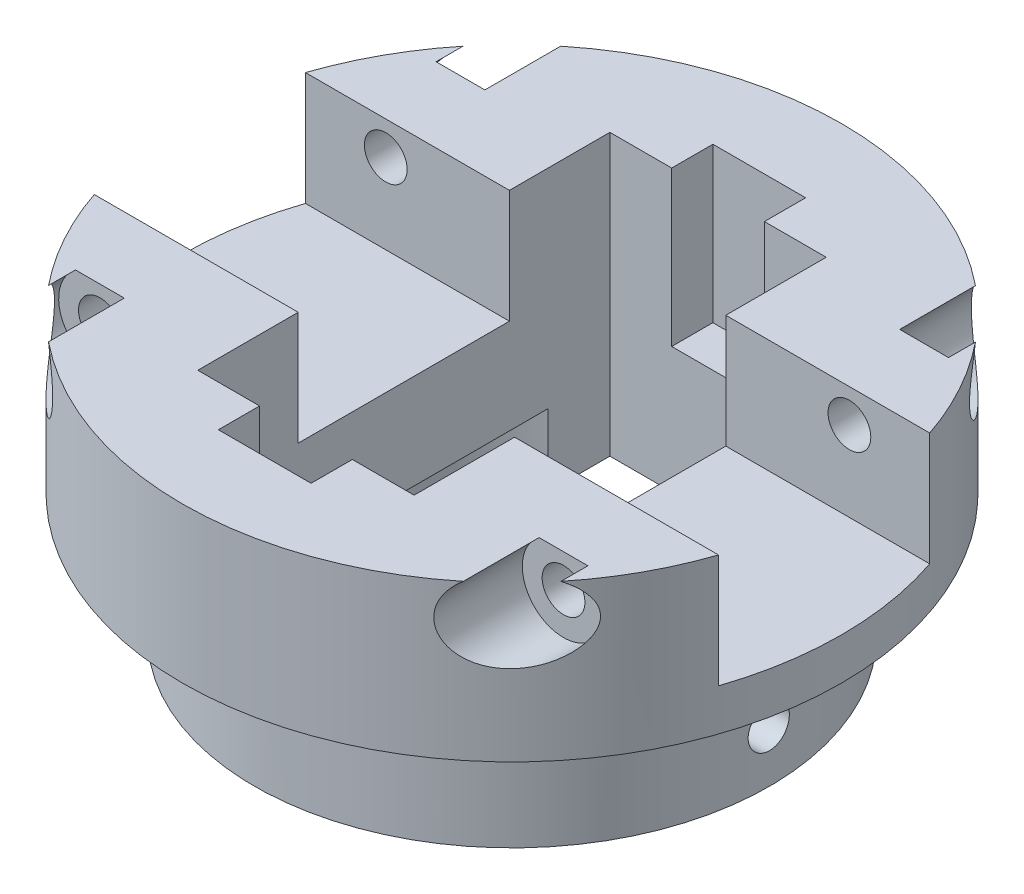
from build123d import *

# Parameters (mm, degrees)
SKETCH1_R               = 22
BOSS_EXTRUDE1_DEPTH     = 5
SKETCH2_R               = 25
BOSS_EXTRUDE2_DEPTH     = 5
SKETCH3_R               = 7.5
CUT_EXTRUDE1_DEPTH      = 16
SKETCH5_W               = 72.120743336
SKETCH5_H               = 20.5
CUT_EXTRUDE2_DEPTH      = 11
CUT_EXTRUDE3_DEPTH      = 53.792161073
CUT_EXTRUDE3_DEPTH_BACK = 53.792161073
SKETCH6_R               = 2.075
BOSS_EXTRUDE3_START     = 5
SKETCH7_R               = 25
SKETCH7_R_2             = 12.5
BOSS_EXTRUDE3_DEPTH     = 5
CUT_EXTRUDE4_DEPTH      = 53.792161246
CUT_EXTRUDE4_DEPTH_BACK = 53.792161246
SKETCH8_R               = 2
SKETCH9_W               = 21
SKETCH9_H               = 40
CUT_EXTRUDE5_DEPTH      = 31
SKETCH11_R              = 17.5
CUT_EXTRUDE7_DEPTH      = 7
CUT_EXTRUDE10_START     = 26.5
SKETCH14_R              = 4
CUT_EXTRUDE10_DEPTH     = 9
SKETCH21_W              = 9
SKETCH21_H              = 4
CUT_EXTRUDE12_DEPTH     = 15
SKETCH22_W              = 9
SKETCH22_H              = 4
CUT_EXTRUDE13_DEPTH     = 15
CUT_EXTRUDE14_START     = -17.5
SKETCH24_R              = 4
CUT_EXTRUDE14_DEPTH     = 15
CUT_EXTRUDE15_START     = -17.5
SKETCH25_R              = 4
CUT_EXTRUDE15_DEPTH     = 15
CUT_EXTRUDE16_START     = 32.5
SKETCH26_R              = 4
CUT_EXTRUDE16_DEPTH     = 15


with BuildPart() as part:
    # Sketch1 → Boss-Extrude1 (new body)
    with BuildSketch(Plane(origin=(0, 0, 0), x_dir=(1, 0, 0), z_dir=(0, 1, 0))):
        Circle(SKETCH1_R)
    extrude(amount=BOSS_EXTRUDE1_DEPTH)

    # Sketch2 → Boss-Extrude2 (add)
    with BuildSketch(Plane(origin=(0, 5, 0), x_dir=(1, 0, 0), z_dir=(0, 1, 0))):
        Circle(SKETCH2_R)
    extrude(amount=BOSS_EXTRUDE2_DEPTH)

    # Sketch3 → Cut-Extrude1 (cut)
    with BuildSketch(Plane(origin=(0, 10, 0), x_dir=(1, 0, 0), z_dir=(0, 1, 0))):
        Circle(SKETCH3_R)
    extrude(amount=-CUT_EXTRUDE1_DEPTH, mode=Mode.SUBTRACT)

    # Sketch4 → Revolve1 (revolve)
    with BuildSketch(Plane(origin=(0, 0, 0), x_dir=(0, 0, -1), z_dir=(1, 0, 0))):
        Polygon((-9.617585302, 7.278489703), (-16.698024184, 7.278489703), (-31.98380954, 12.164514858), (-31.98380954, 27.222860345), (-9.617585302, 27.222860345), align=None)
    revolve(axis=Axis((0, 0, 0), (0, 1, 0)))

    # Sketch5 → Cut-Extrude2 (cut)
    with BuildSketch(Plane(origin=(0, 27.222860345, 0), x_dir=(1, 0, 0), z_dir=(0, 1, 0))):
        Rectangle(SKETCH5_W, SKETCH5_H)
    extrude(amount=-CUT_EXTRUDE2_DEPTH, mode=Mode.SUBTRACT)

    # Sketch6 → Cut-Extrude3 (cut, two sides: drawn at the far end of the back side and taken through both)
    with BuildSketch(Plane.XY.offset(-CUT_EXTRUDE3_DEPTH_BACK)):
        with Locations((-22.5, 24)):
            Circle(SKETCH6_R)
        with Locations((22.5, 24)):
            Circle(SKETCH6_R)
    extrude(amount=CUT_EXTRUDE3_DEPTH + CUT_EXTRUDE3_DEPTH_BACK, mode=Mode.SUBTRACT)

    # Sketch7 → Boss-Extrude3 (add)
    with BuildSketch(Plane.XZ.offset(-5).offset(BOSS_EXTRUDE3_START)):
        Circle(SKETCH7_R)
        Circle(SKETCH7_R_2, mode=Mode.SUBTRACT)
    extrude(amount=-BOSS_EXTRUDE3_DEPTH)

    # Sketch8 → Cut-Extrude4 (cut, two sides: drawn at the far end of the back side and taken through both)
    with BuildSketch(Plane(origin=(0, 0, 0), x_dir=(0, 0, -1), z_dir=(1, 0, 0)).offset(-CUT_EXTRUDE4_DEPTH_BACK)):
        with Locations((0, 5)):
            Circle(SKETCH8_R)
    extrude(amount=CUT_EXTRUDE4_DEPTH + CUT_EXTRUDE4_DEPTH_BACK, mode=Mode.SUBTRACT)

    # Sketch9 → Cut-Extrude5 (cut)
    with BuildSketch(Plane(origin=(0, 27.222860345, 0), x_dir=(1, 0, 0), z_dir=(0, 1, 0))):
        Rectangle(SKETCH9_W, SKETCH9_H)
    extrude(amount=-CUT_EXTRUDE5_DEPTH, mode=Mode.SUBTRACT)

    # Sketch11 → Cut-Extrude7 (cut)
    with BuildSketch(Plane.XZ):
        Circle(SKETCH11_R)
    extrude(amount=-CUT_EXTRUDE7_DEPTH, mode=Mode.SUBTRACT)

    # Sketch14 → Cut-Extrude10 (cut)
    with BuildSketch(Plane.XY.offset(CUT_EXTRUDE10_START)):
        with Locations((22.5, 24)):
            Circle(SKETCH14_R)
    extrude(amount=-CUT_EXTRUDE10_DEPTH, mode=Mode.SUBTRACT)

    # Sketch21 → Cut-Extrude12 (cut)
    with BuildSketch(Plane(origin=(0, 27.222860345, 0), x_dir=(1, 0, 0), z_dir=(0, 1, 0))):
        with Locations((0, -22)):
            Rectangle(SKETCH21_W, SKETCH21_H)
    extrude(amount=-CUT_EXTRUDE12_DEPTH, mode=Mode.SUBTRACT)

    # Sketch22 → Cut-Extrude13 (cut)
    with BuildSketch(Plane(origin=(0, 27.222860345, 0), x_dir=(1, 0, 0), z_dir=(0, 1, 0))):
        with Locations((0, 22)):
            Rectangle(SKETCH22_W, SKETCH22_H)
    extrude(amount=-CUT_EXTRUDE13_DEPTH, mode=Mode.SUBTRACT)

    # Sketch24 → Cut-Extrude14 (cut)
    with BuildSketch(Plane.XY.offset(CUT_EXTRUDE14_START)):
        with Locations((22.5, 24)):
            Circle(SKETCH24_R)
    extrude(amount=-CUT_EXTRUDE14_DEPTH, mode=Mode.SUBTRACT)

    # Sketch25 → Cut-Extrude15 (cut)
    with BuildSketch(Plane.XY.offset(CUT_EXTRUDE15_START)):
        with Locations((-22.5, 24)):
            Circle(SKETCH25_R)
    extrude(amount=-CUT_EXTRUDE15_DEPTH, mode=Mode.SUBTRACT)

    # Sketch26 → Cut-Extrude16 (cut)
    with BuildSketch(Plane.XY.offset(CUT_EXTRUDE16_START)):
        with Locations((-22.5, 24)):
            Circle(SKETCH26_R)
    extrude(amount=-CUT_EXTRUDE16_DEPTH, mode=Mode.SUBTRACT)


solid = part.part
